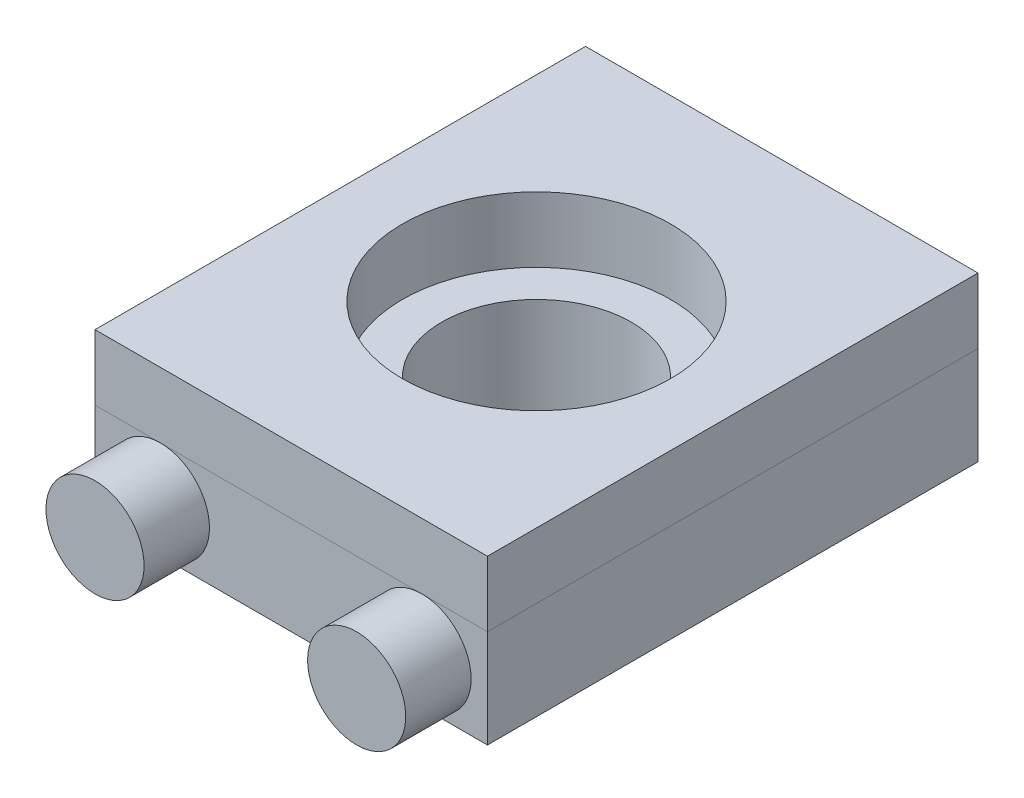
from build123d import *

# Parameters (mm, degrees)
SKETCH_1_W      = 12
SKETCH_1_H      = 15
SKETCH_1_R      = 2.9
EXTRUDE_1_DEPTH = 3
SKETCH_3_W      = 12
SKETCH_3_H      = 15
SKETCH_3_R      = 4.1
EXTRUDE_2_DEPTH = 2
SKETCH_7_R      = 1.5
EXTRUDE_3_DEPTH = 2


with BuildPart() as part:
    # 草图1 → 凸台-拉伸1 (new body)
    with BuildSketch(Plane(origin=(0, 0, 0), x_dir=(1, 0, 0), z_dir=(0, 1, 0))):
        with Locations((6, 7.5)):
            Rectangle(SKETCH_1_W, SKETCH_1_H)
        with Locations(Location((6, 7.5, 0), (0, 0, 270))):
            Circle(SKETCH_1_R, mode=Mode.SUBTRACT)
    extrude(amount=EXTRUDE_1_DEPTH)

    # 草图7 → 凸台-拉伸3 (add)
    with BuildSketch(Plane.XY):
        with Locations(Location((2, 1.5, 0), (0, 0, 270))):
            Circle(SKETCH_7_R)
        with Locations(Location((10, 1.5, 0), (0, 0, 180))):
            Circle(SKETCH_7_R)
    extrude(amount=EXTRUDE_3_DEPTH)


with BuildPart() as body_2:
    # 草图3 → 凸台-拉伸2 (new body)
    with BuildSketch(Plane(origin=(0, 3, 0), x_dir=(1, 0, 0), z_dir=(0, 1, 0))):
        with Locations((6, 7.5)):
            Rectangle(SKETCH_3_W, SKETCH_3_H)
        with Locations(Location((6, 7.5, 0), (0, 0, 270))):
            Circle(SKETCH_3_R, mode=Mode.SUBTRACT)
    extrude(amount=EXTRUDE_2_DEPTH)


solid = Compound([part.part, body_2.part])
